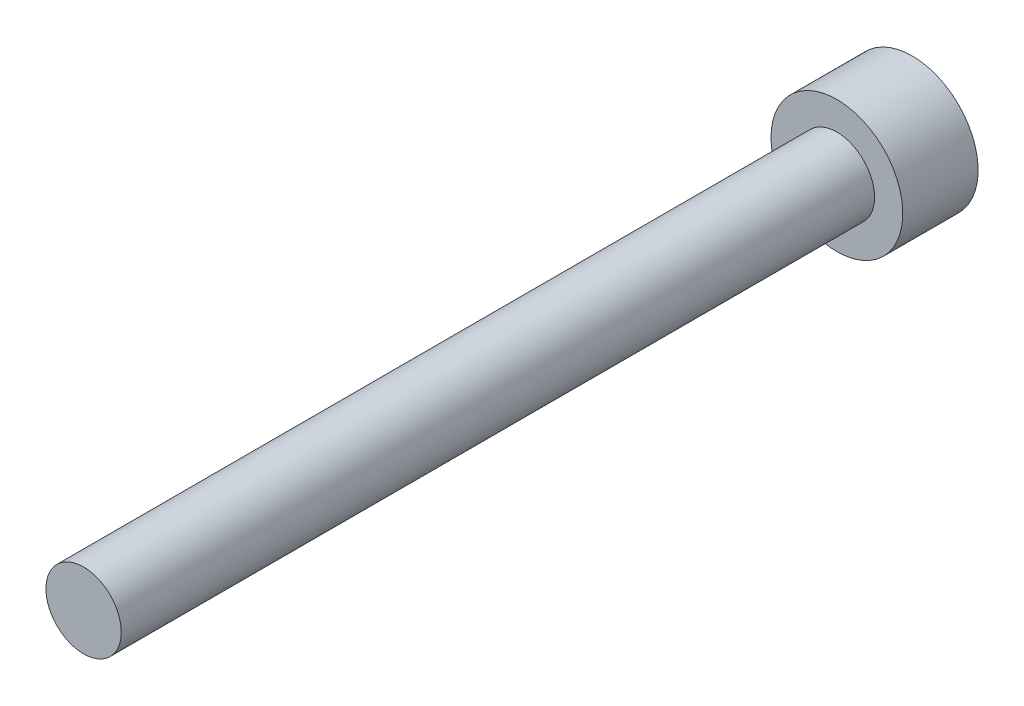
from build123d import *

# Parameters (mm, degrees)
SKETCH1_W           = 3.5
SKETCH1_H           = 4
SKETCH2_R           = 2
BOSS_EXTRUDE1_DEPTH = 20
SKETCH3_R           = 2
BOSS_EXTRUDE2_DEPTH = 20
CUT_EXTRUDE1_DEPTH  = 2.4


with BuildPart() as part:
    # Sketch1 → Revolve1 (revolve)
    with BuildSketch(Plane.XZ, mode=Mode.PRIVATE) as revolve1_sk:
        with Locations((1.75, 2)):
            Rectangle(SKETCH1_W, SKETCH1_H)
    revolve(revolve1_sk.sketch.rotate(Axis((0, 0, 4), (0, 0, -1)), 180), axis=Axis((0, 0, 4), (0, 0, -1)))

    # Sketch2 → Boss-Extrude1 (add)
    with BuildSketch(Plane.XY.offset(4)):
        Circle(SKETCH2_R)
    extrude(amount=BOSS_EXTRUDE1_DEPTH)

    # Sketch3 → Boss-Extrude2 (add)
    with BuildSketch(Plane.XY.offset(24)):
        Circle(SKETCH3_R)
    extrude(amount=BOSS_EXTRUDE2_DEPTH)

    # Sketch4 → Cut-Extrude1 (cut)
    with BuildSketch(Plane(origin=(0, 0, 0), x_dir=(-1, 0, 0), z_dir=(0, 0, -1))):
        Polygon((-1.7, 0), (-0.85, -1.472243186), (0.85, -1.472243186), (1.7, 0), (0.85, 1.472243186), (-0.85, 1.472243186), align=None)
    extrude(amount=-CUT_EXTRUDE1_DEPTH, mode=Mode.SUBTRACT)


solid = part.part
